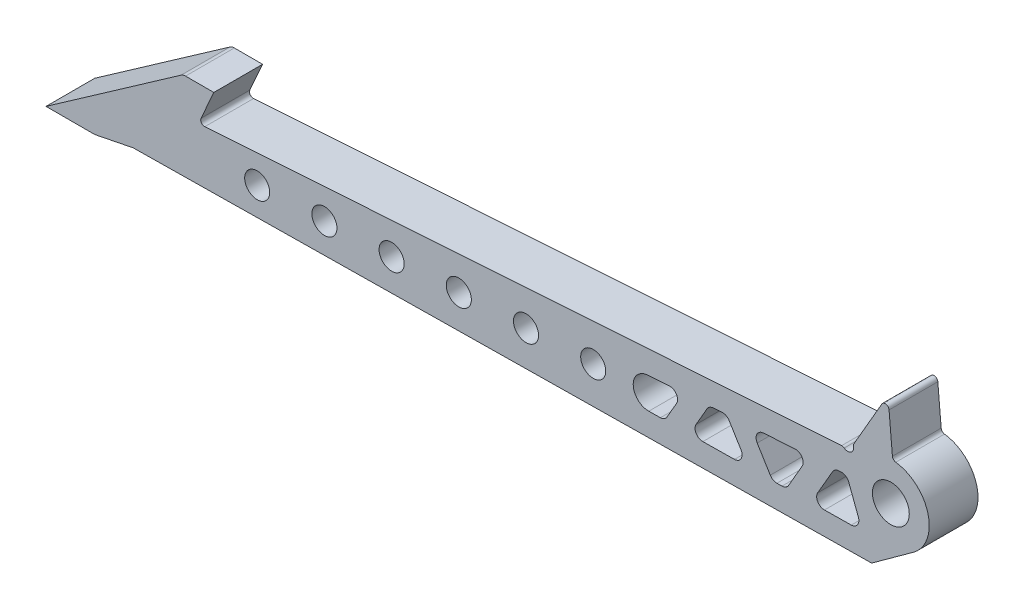
from build123d import *

# Parameters (mm, degrees)
SKETCH1_R           = 3.2639
SKETCH1_R_2         = 4.8025
BOSS_EXTRUDE1_DEPTH = 12.7
SKETCH2_R           = 1.5
CUT_EXTRUDE1_DEPTH  = 227.41953776
EXTRUDE_THIN1_DEPTH = 12.7
FILLET1_R           = 2
FILLET2_R           = 1
FILLET3_R           = 1
FILLET4_R           = 2
FILLET5_R           = 1


with BuildPart() as part:
    # Sketch1 → Boss-Extrude1 (new body)
    with BuildSketch(Plane.XY):
        with BuildLine():
            Line((-196.801436578, 66.762186411), (-184.101436578, 66.762186411))
            Line((-184.101436578, 66.762186411), (-174.101436578, 68.762186411))
            Line((-174.101436578, 68.762186411), (18.198563422, 71.262186411))
            Line((18.198563422, 71.262186411), (29.067448443, 79.140508783))
            ThreePointArc((29.067448443, 79.140508783), (32.782860984, 90.090472281), (23.683493494, 97.225421632))
            Line((23.683493494, 97.225421632), (22.457622919, 111.237186411))
            Line((22.457622919, 111.237186411), (12.506829792, 94.001907138))
            Line((12.506829792, 94.001907138), (-157.097736409, 82.762186411))
            Line((-157.097736409, 82.762186411), (-153.097736409, 91.762186411))
            Line((-153.097736409, 91.762186411), (-161.097736409, 91.762186411))
            Line((-161.097736409, 91.762186411), (-196.801436578, 66.762186411))
        make_face()
        with Locations((-141.801436578, 76.478988882)):
            Circle(SKETCH1_R, mode=Mode.SUBTRACT)
        with BuildLine():
            ThreePointArc((-121.040083953, 77.299723999), (-124.172509206, 73.909444003), (-127.562789202, 77.041869256))
            ThreePointArc((-127.562789202, 77.041869256), (-124.430363949, 80.432149252), (-121.040083953, 77.299723999))
        make_face(mode=Mode.SUBTRACT)
        with BuildLine():
            ThreePointArc((-103.540083953, 77.991531744), (-106.672509206, 74.601251748), (-110.062789202, 77.733677001))
            ThreePointArc((-110.062789202, 77.733677001), (-106.930363949, 81.123956997), (-103.540083953, 77.991531744))
        make_face(mode=Mode.SUBTRACT)
        with BuildLine():
            ThreePointArc((-86.040083953, 78.68333949), (-89.172509206, 75.293059493), (-92.562789202, 78.425484746))
            ThreePointArc((-92.562789202, 78.425484746), (-89.430363949, 81.815764743), (-86.040083953, 78.68333949))
        make_face(mode=Mode.SUBTRACT)
        with BuildLine():
            ThreePointArc((-68.540083953, 79.375147235), (-71.672509206, 75.984867239), (-75.062789202, 79.117292491))
            ThreePointArc((-75.062789202, 79.117292491), (-71.930363949, 82.507572488), (-68.540083953, 79.375147235))
        make_face(mode=Mode.SUBTRACT)
        with Locations((-54.301436578, 79.938027609)):
            Circle(SKETCH1_R, mode=Mode.SUBTRACT)
        with BuildLine():
            ThreePointArc((-39.833809225, 76.508242407), (-43.882673124, 80.349599411), (-40.150307356, 84.499149782))
            Line((-40.150307356, 84.499149782), (11.706060944, 87.935679297))
            Line((11.706060944, 87.935679297), (15.760597764, 77.230998609))
            Line((15.760597764, 77.230998609), (-39.833809225, 76.508242407))
        make_face(mode=Mode.SUBTRACT)
        with Locations((23.198563422, 87.237186411)):
            Circle(SKETCH1_R_2, mode=Mode.SUBTRACT)
    extrude(amount=BOSS_EXTRUDE1_DEPTH)

    # Sketch2 → Cut-Extrude1 (cut, through all)
    with BuildSketch(Plane.XY.offset(12.7)):
        with Locations((11.978454756, 94.850918223)):
            Circle(SKETCH2_R)
    extrude(amount=-CUT_EXTRUDE1_DEPTH, mode=Mode.SUBTRACT)

    # Sketch3 → Extrude-Thin1 (add)
    with BuildSketch(Plane.XY.offset(12.7)):
        Polygon((4.374887162, 91.481339263), (2.874887162, 88.883263052), (-3.183006438, 78.390683549), (-4.683006438, 75.792607338), (0.080133283, 73.042607338), (1.580133283, 75.640683549), (7.638026883, 86.133263052), (9.138026883, 88.731339263), align=None)
        Polygon((-6.366359526, 74.910825854), (-8.455450886, 78.321939644), (-14.081085771, 87.507598585), (-16.170177131, 90.918712375), (-20.860458592, 88.046211754), (-18.771367232, 84.635097964), (-13.145732348, 75.449439024), (-11.056640987, 72.038325234), align=None)
        Polygon((-28.307796362, 89.315452792), (-29.807796362, 86.71737658), (-34.852924598, 77.978958144), (-36.352924598, 75.380881933), (-31.589784877, 72.630881933), (-30.089784877, 75.228958144), (-25.044656641, 83.96737658), (-23.544656641, 86.565452792), align=None)
    extrude(amount=-EXTRUDE_THIN1_DEPTH)

    # Fillet1
    fillet1_edges = [part.edges().sort_by_distance(p)[0] for p in [
        (-4.000877594, 76.974089152, 6.35),
        (1.954701783, 87.289455223, 6.35),
        (2.398004439, 77.057277946, 6.35),
        (8.558212262, 87.72707088, 6.35),
        (-13.999872127, 76.844097024, 6.35),
        (-19.525203724, 85.865978577, 6.35),
        (-7.601311108, 76.927281645, 6.35),
        (-13.327249279, 86.276717973, 6.35),
        (-35.670795755, 76.562363747, 6.35),
        (-30.727981741, 85.123568752, 6.35),
        (-29.271913721, 76.645552541, 6.35),
        (-24.124471262, 85.561184409, 6.35),
        (15.760597764, 77.230998609, 6.35),
        (11.706060944, 87.935679297, 6.35),
    ]]
    fillet(fillet1_edges, radius=FILLET1_R)

    # Fillet2
    fillet2_edges = [part.edges().sort_by_distance(p)[0] for p in [
        (13.348980962, 95.460555753, 6.35),
        (10.826213816, 93.890532459, 6.35),
    ]]
    fillet(fillet2_edges, radius=FILLET2_R)

    # Fillet3
    fillet3_edges = [part.edges().sort_by_distance(p)[0] for p in [
        (-157.097736409, 82.762186411, 6.35),
    ]]
    fillet(fillet3_edges, radius=FILLET3_R)

    # Fillet4
    fillet4_edges = [part.edges().sort_by_distance(p)[0] for p in [
        (-161.097736409, 91.762186411, 6.35),
    ]]
    fillet(fillet4_edges, radius=FILLET4_R)

    # Fillet5
    fillet5_edges = [part.edges().sort_by_distance(p)[0] for p in [
        (22.457622919, 111.237186411, 6.35),
        (23.683493494, 97.225421632, 6.35),
    ]]
    fillet(fillet5_edges, radius=FILLET5_R)


solid = part.part
